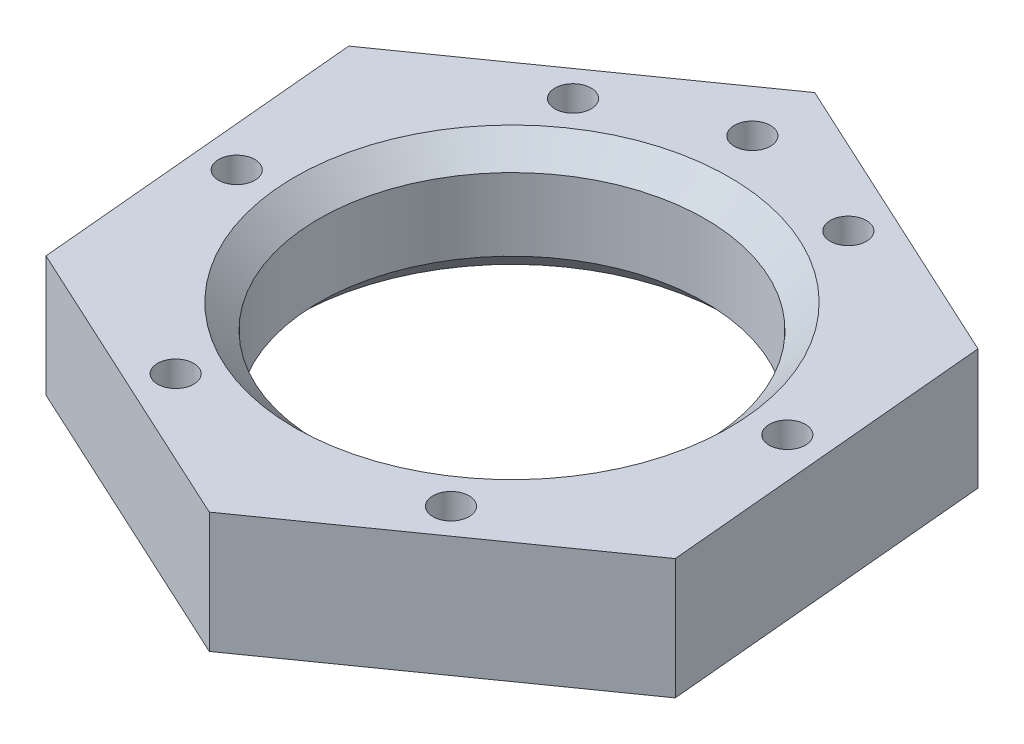
from build123d import *

# Parameters (mm, degrees)
BOSS_EXTRUDE1_DEPTH = 6.35
SKETCH2_R           = 10.16
CUT_EXTRUDE1_DEPTH  = 25.548672232
CHAMFER1_SIZE       = 1.27
SKETCH4_R           = 0.9525
CUT_EXTRUDE2_DEPTH  = 25.548672232


with BuildPart() as part:
    # Sketch1 → Boss-Extrude1 (new body)
    with BuildSketch(Plane(origin=(0, 0, 0), x_dir=(1, 0, 0), z_dir=(0, 1, 0))):
        Polygon((1.59389926, -17.525304139), (15.974308223, -7.382294819), (14.380408963, 10.143009319), (-1.59389926, 17.525304139), (-15.974308223, 7.382294819), (-14.380408963, -10.143009319), align=None)
    extrude(amount=BOSS_EXTRUDE1_DEPTH)

    # Sketch2 → Cut-Extrude1 (cut, through all)
    with BuildSketch(Plane(origin=(0, 6.35, 0), x_dir=(1, 0, 0), z_dir=(0, 1, 0))):
        with Locations(Location((0, 0, 0), (0, 0, 270))):
            Circle(SKETCH2_R)
    extrude(amount=-CUT_EXTRUDE1_DEPTH, mode=Mode.SUBTRACT)

    # Chamfer1
    chamfer1_edges = [part.edges().sort_by_distance(p)[0] for p in [
        (0, 0, -10.16),
        (0, 6.35, -10.16),
    ]]
    chamfer(chamfer1_edges, length=CHAMFER1_SIZE)

    # Sketch4 → Cut-Extrude2 (cut, through all)
    with BuildSketch(Plane(origin=(0, 6.35, 0), x_dir=(1, 0, 0), z_dir=(0, 1, 0))):
        with Locations(Location((-7.686090774, 10.897074544, 0), (0, 0, 270))):
            Circle(SKETCH4_R)
        with Locations(Location((5.594097995, 12.104887138, 0), (0, 0, 270))):
            Circle(SKETCH4_R)
        with Locations(Location((13.280188769, 1.207812594, 0), (0, 0, 270))):
            Circle(SKETCH4_R)
        with Locations(Location((7.686090774, -10.897074544, 0), (0, 0, 270))):
            Circle(SKETCH4_R)
        with Locations(Location((-5.594097995, -12.104887138, 0), (0, 0, 270))):
            Circle(SKETCH4_R)
        with Locations(Location((-1.265327479, 13.91257871, 0), (0, 0, 270))):
            Circle(SKETCH4_R)
        with Locations(Location((-13.280188769, -1.207812594, 0), (0, 0, 270))):
            Circle(SKETCH4_R)
    extrude(amount=-CUT_EXTRUDE2_DEPTH, mode=Mode.SUBTRACT)


solid = part.part
